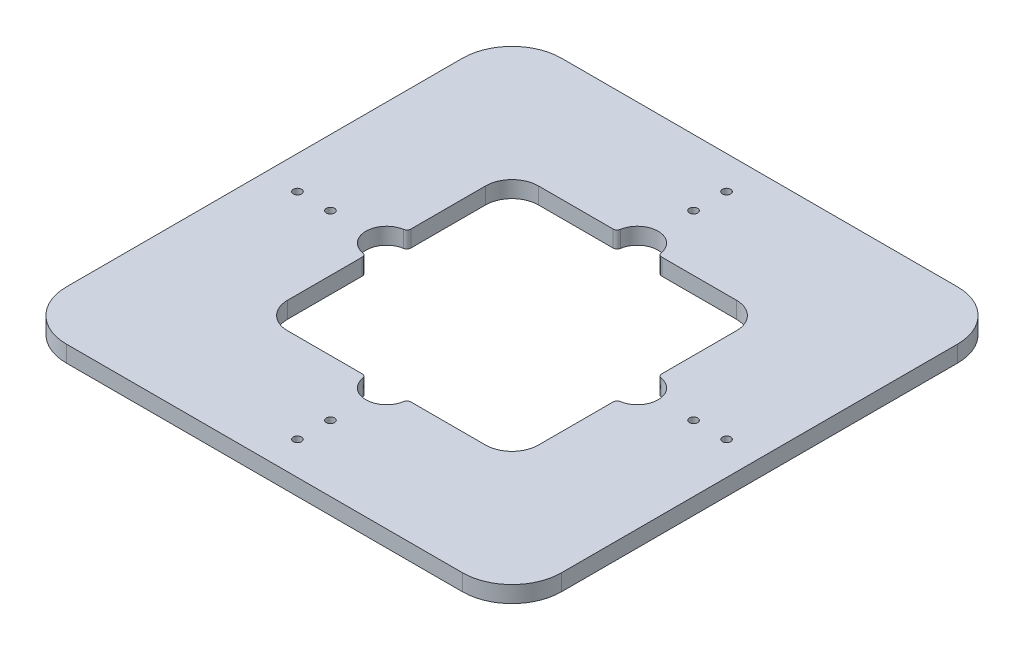
from build123d import *

# Parameters (mm, degrees)
BOSS_EXTRUDE3_DEPTH = 4
SKETCH2_R           = 2.5
BOSS_EXTRUDE4_DEPTH = 10
CUT_EXTRUDE1_DEPTH  = 52
CUT_EXTRUDE2_DEPTH  = 10


with BuildPart() as part:
    # Sketch1 → Boss-Extrude3 (new body)
    with BuildSketch(Plane(origin=(0, 0, 0), x_dir=(1, 0, 0), z_dir=(0, 1, 0))):
        with BuildLine():
            ThreePointArc((-75, -60), (-70.606601718, -70.606601718), (-60, -75))
            Line((-60, -75), (60, -75))
            ThreePointArc((60, -75), (70.606601718, -70.606601718), (75, -60))
            Line((75, -60), (75, 60))
            ThreePointArc((75, 60), (70.606601718, 70.606601718), (60, 75))
            Line((60, 75), (-60, 75))
            ThreePointArc((-60, 75), (-70.606601718, 70.606601718), (-75, 60))
            Line((-75, 60), (-75, -60))
        make_face()
    extrude(amount=BOSS_EXTRUDE3_DEPTH)

    # Sketch3 → Cut-Extrude1 (cut)
    with BuildSketch(Plane(origin=(0, 14, 0), x_dir=(1, 0, 0), z_dir=(0, 1, 0))):
        with BuildLine():
            Line((-60, 76), (60, 76))
            ThreePointArc((60, 76), (71.313708499, 71.313708499), (76, 60))
            Line((76, 60), (76, -60))
            ThreePointArc((76, -60), (71.313708499, -71.313708499), (60, -76))
            Line((60, -76), (-60, -76))
            ThreePointArc((-60, -76), (-71.313708499, -71.313708499), (-76, -60))
            Line((-76, -60), (-76, 60))
            ThreePointArc((-76, 60), (-71.313708499, 71.313708499), (-60, 76))
        make_face()
    extrude(amount=-CUT_EXTRUDE1_DEPTH, mode=Mode.SUBTRACT)


with BuildPart() as body_2:
    # Sketch2 → Boss-Extrude4 (new body)
    # profile 1 of 5: a face of its own
    with BuildSketch(Plane(origin=(0, 4, 0), x_dir=(1, 0, 0), z_dir=(0, 1, 0))):
        with BuildLine():
            ThreePointArc((150, -120), (141.213203436, -141.213203436), (120, -150))
            Line((120, -150), (-120, -150))
            ThreePointArc((-120, -150), (-141.213203436, -141.213203436), (-150, -120))
            Line((-150, -120), (-150, 120))
            ThreePointArc((-150, 120), (-141.213203436, 141.213203436), (-120, 150))
            Line((-120, 150), (120, 150))
            ThreePointArc((120, 150), (141.213203436, 141.213203436), (150, 120))
            Line((150, 120), (150, -120))
        make_face()
        with Locations(Location((-110, 0, 0), (0, 0, 270))):
            Circle(SKETCH2_R, mode=Mode.SUBTRACT)
        with Locations(Location((-130, 0, 0), (0, 0, 270))):
            Circle(SKETCH2_R, mode=Mode.SUBTRACT)
        with Locations(Location((130, 0, 0), (0, 0, 270))):
            Circle(SKETCH2_R, mode=Mode.SUBTRACT)
        with Locations(Location((110, 0, 0), (0, 0, 270))):
            Circle(SKETCH2_R, mode=Mode.SUBTRACT)
        with Locations(Location((0, -130, 0), (0, 0, 270))):
            Circle(SKETCH2_R, mode=Mode.SUBTRACT)
        with Locations(Location((0, -110, 0), (0, 0, 270))):
            Circle(SKETCH2_R, mode=Mode.SUBTRACT)
        with Locations(Location((0, 110, 0), (0, 0, 270))):
            Circle(SKETCH2_R, mode=Mode.SUBTRACT)
        with Locations(Location((0, 130, 0), (0, 0, 270))):
            Circle(SKETCH2_R, mode=Mode.SUBTRACT)
        Polygon((-76, -76), (-76, 76), (0, 76), (76, 76), (76, -76), align=None, mode=Mode.SUBTRACT)
    # profile 2 of 5: a face of its own
    with BuildSketch(Plane(origin=(0, 4, 0), x_dir=(1, 0, 0), z_dir=(0, 1, 0))):
        with BuildLine():
            ThreePointArc((-60, -76), (-71.313708499, -71.313708499), (-76, -60))
            Line((-76, -60), (-76, -76))
            Line((-76, -76), (-60, -76))
        make_face()
    # profile 3 of 5: a face of its own
    with BuildSketch(Plane(origin=(0, 4, 0), x_dir=(1, 0, 0), z_dir=(0, 1, 0))):
        with BuildLine():
            Line((76, -76), (76, -60))
            ThreePointArc((76, -60), (71.313708499, -71.313708499), (60, -76))
            Line((60, -76), (76, -76))
        make_face()
    # profile 4 of 5: a face of its own
    with BuildSketch(Plane(origin=(0, 4, 0), x_dir=(1, 0, 0), z_dir=(0, 1, 0))):
        with BuildLine():
            Line((76, 76), (60, 76))
            ThreePointArc((60, 76), (71.313708499, 71.313708499), (76, 60))
            Line((76, 60), (76, 76))
        make_face()
    # profile 5 of 5: a face of its own
    with BuildSketch(Plane(origin=(0, 4, 0), x_dir=(1, 0, 0), z_dir=(0, 1, 0))):
        with BuildLine():
            ThreePointArc((-76, 60), (-71.313708499, 71.313708499), (-60, 76))
            Line((-60, 76), (-76, 76))
            Line((-76, 76), (-76, 60))
        make_face()
    extrude(amount=BOSS_EXTRUDE4_DEPTH)

    # Sketch4 → Cut-Extrude2 (cut)
    with BuildSketch(Plane(origin=(0, 14, 0), x_dir=(1, 0, 0), z_dir=(0, 1, 0))):
        with BuildLine():
            Line((-12.5, 76), (12.5, 76))
            ThreePointArc((12.5, 76), (12.456214868, 77.045328257), (12.325166214, 78.08333334))
            ThreePointArc((12.325166214, 78.08333334), (-7.4e-08, 88.5), (-12.325166239, 78.083333193))
            ThreePointArc((-12.325166239, 78.083333193), (-12.456214874, 77.045328183), (-12.5, 76))
        make_face()
        with BuildLine():
            ThreePointArc((-12.5, 76), (0, 63.5), (12.5, 76))
            Line((12.5, 76), (-12.5, 76))
        make_face()
        with BuildLine():
            Line((-14.790199458, 76), (-12.5, 76))
            ThreePointArc((-12.5, 76), (-12.456214874, 77.045328183), (-12.325166239, 78.083333193))
            ThreePointArc((-12.325166239, 78.083333193), (-13.176456451, 76.590593415), (-14.790199458, 76))
        make_face()
        with BuildLine():
            ThreePointArc((12.325166214, 78.08333334), (12.456214868, 77.045328257), (12.5, 76))
            Line((12.5, 76), (14.790199431, 76))
            ThreePointArc((14.790199431, 76), (13.176456384, 76.590593471), (12.325166214, 78.08333334))
        make_face()
        with BuildLine():
            ThreePointArc((-76, -12.5), (-67.161165235, -8.838834765), (-63.5, 0))
            ThreePointArc((-63.5, 0), (-67.161165235, 8.838834765), (-76, 12.5))
            Line((-76, 12.5), (-76, -12.5))
        make_face()
        with BuildLine():
            Line((-76, -12.5), (-76, 12.5))
            ThreePointArc((-76, 12.5), (-77.045330875, 12.456214648), (-78.083338522, 12.325165338))
            ThreePointArc((-78.083338522, 12.325165338), (-88.5, -1.364e-06), (-78.083335831, -12.325165793))
            ThreePointArc((-78.083335831, -12.325165793), (-77.045329516, -12.456214762), (-76, -12.5))
        make_face()
        with BuildLine():
            ThreePointArc((-78.083338522, 12.325165338), (-77.045330875, 12.456214648), (-76, 12.5))
            Line((-76, 12.5), (-76, 14.790199458))
            ThreePointArc((-76, 14.790199458), (-76.590595159, 13.176454387), (-78.083338522, 12.325165338))
        make_face()
        with BuildLine():
            Line((-76, -14.790199458), (-76, -12.5))
            ThreePointArc((-76, -12.5), (-77.045329516, -12.456214762), (-78.083335831, -12.325165793))
            ThreePointArc((-78.083335831, -12.325165793), (-76.590594278, -13.17645543), (-76, -14.790199458))
        make_face()
        with BuildLine():
            Line((-12.5, -76), (12.5, -76))
            ThreePointArc((12.5, -76), (0, -63.5), (-12.5, -76))
        make_face()
        with BuildLine():
            ThreePointArc((12.325166095, -78.08333404), (12.456214838, -77.04532861), (12.5, -76))
            Line((12.5, -76), (-12.5, -76))
            ThreePointArc((-12.5, -76), (-12.456214619, -77.045331227), (-12.32516522, -78.083339217))
            ThreePointArc((-12.32516522, -78.083339217), (2.625e-06, -88.5), (12.325166095, -78.08333404))
        make_face()
        with BuildLine():
            ThreePointArc((-12.32516522, -78.083339217), (-12.456214619, -77.045331227), (-12.5, -76))
            Line((-12.5, -76), (-14.790199456, -76))
            ThreePointArc((-14.790199456, -76), (-13.176454117, -76.590595387), (-12.32516522, -78.083339217))
        make_face()
        with BuildLine():
            Line((14.790199458, -76), (12.5, -76))
            ThreePointArc((12.5, -76), (12.456214838, -77.04532861), (12.325166095, -78.08333404))
            ThreePointArc((12.325166095, -78.08333404), (13.176456123, -76.590593692), (14.790199458, -76))
        make_face()
        with BuildLine():
            ThreePointArc((78.083330118, -12.325166758), (85.547031645, -8.06871655), (88.5, 0))
            ThreePointArc((88.5, 0), (85.547032724, 8.068715273), (78.083333414, 12.325166201))
            ThreePointArc((78.083333414, 12.325166201), (77.045328294, 12.456214865), (76, 12.5))
            Line((76, 12.5), (76, -12.5))
            ThreePointArc((76, -12.5), (77.045326629, -12.456215005), (78.083330118, -12.325166758))
        make_face()
        with BuildLine():
            Line((76, -12.5), (76, 12.5))
            ThreePointArc((76, 12.5), (63.5, 0), (76, -12.5))
        make_face()
        with BuildLine():
            ThreePointArc((76, 12.5), (77.045328294, 12.456214865), (78.083333414, 12.325166201))
            ThreePointArc((78.083333414, 12.325166201), (76.590593423, 13.176456442), (76, 14.790199657))
            Line((76, 14.790199657), (76, 12.5))
        make_face()
        with BuildLine():
            ThreePointArc((76, -14.790199258), (76.590592472, -13.176457566), (78.083330118, -12.325166758))
            ThreePointArc((78.083330118, -12.325166758), (77.045326629, -12.456215005), (76, -12.5))
            Line((76, -12.5), (76, -14.790199258))
        make_face()
    extrude(amount=-CUT_EXTRUDE2_DEPTH, mode=Mode.SUBTRACT)


solid = body_2.part
